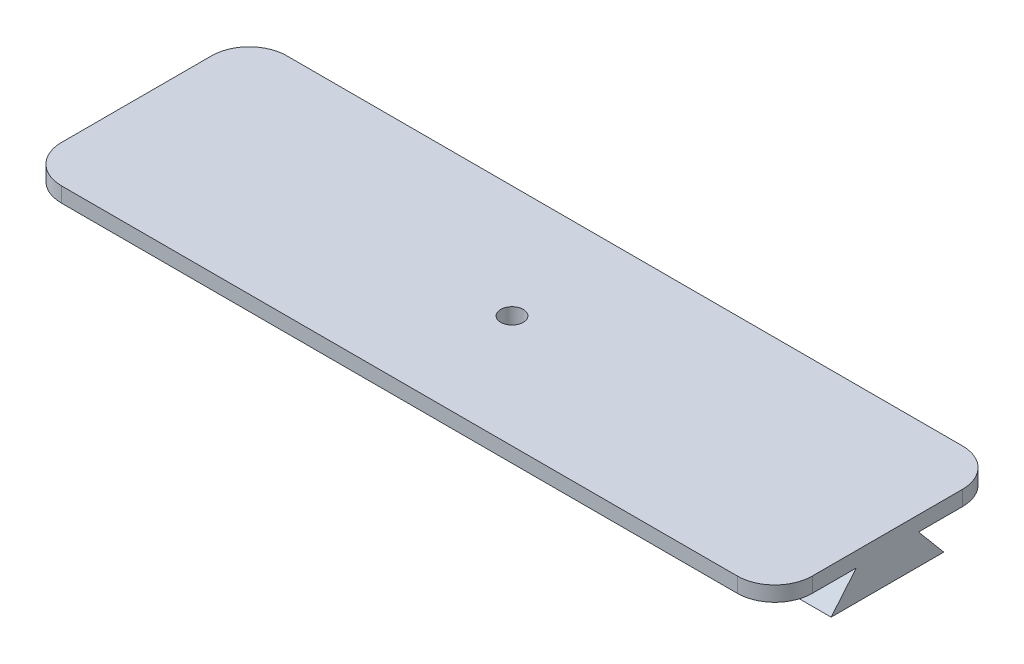
from build123d import *

# Parameters (mm, degrees)
SKETCH4_W           = 100
SKETCH4_H           = 30
BOSS_EXTRUDE2_DEPTH = 6
CUT_EXTRUDE1_DEPTH  = 105.575331699
SKETCH7_R           = 1.5
CUT_EXTRUDE2_DEPTH  = 105.575331699
FILLET2_R           = 5
FILLET3_R           = 5


with BuildPart() as part:
    # Sketch4 → Boss-Extrude2 (new body)
    with BuildSketch(Plane(origin=(0, 0, 0), x_dir=(1, 0, 0), z_dir=(0, 1, 0))):
        with Locations((50, -15)):
            Rectangle(SKETCH4_W, SKETCH4_H)
    extrude(amount=BOSS_EXTRUDE2_DEPTH)

    # Sketch6 → Cut-Extrude1 (cut, through all)
    with BuildSketch(Plane(origin=(100, 0, 0), x_dir=(0, 0, -1), z_dir=(1, 0, 0))):
        Polygon((-7.5, 0), (0, 0), (0, 4), (-10.856398525, 4), align=None)
        Polygon((-22.5, 0), (-30, 0), (-30, 4), (-19.143601475, 4), align=None)
    extrude(amount=-CUT_EXTRUDE1_DEPTH, mode=Mode.SUBTRACT)

    # Sketch7 → Cut-Extrude2 (cut, through all)
    with BuildSketch(Plane(origin=(0, 6, 0), x_dir=(1, 0, 0), z_dir=(0, 1, 0))):
        with Locations(Location((50, -15, 0), (0, 0, 270))):
            Circle(SKETCH7_R)
    extrude(amount=-CUT_EXTRUDE2_DEPTH, mode=Mode.SUBTRACT)

    # Fillet2
    fillet2_edges = [part.edges().sort_by_distance(p)[0] for p in [
        (0, 5, 0),
    ]]
    fillet(fillet2_edges, radius=FILLET2_R)

    # Fillet3
    fillet3_edges = [part.edges().sort_by_distance(p)[0] for p in [
        (100, 5, 0),
        (100, 5, 30),
        (0, 5, 30),
    ]]
    fillet(fillet3_edges, radius=FILLET3_R)


solid = part.part
